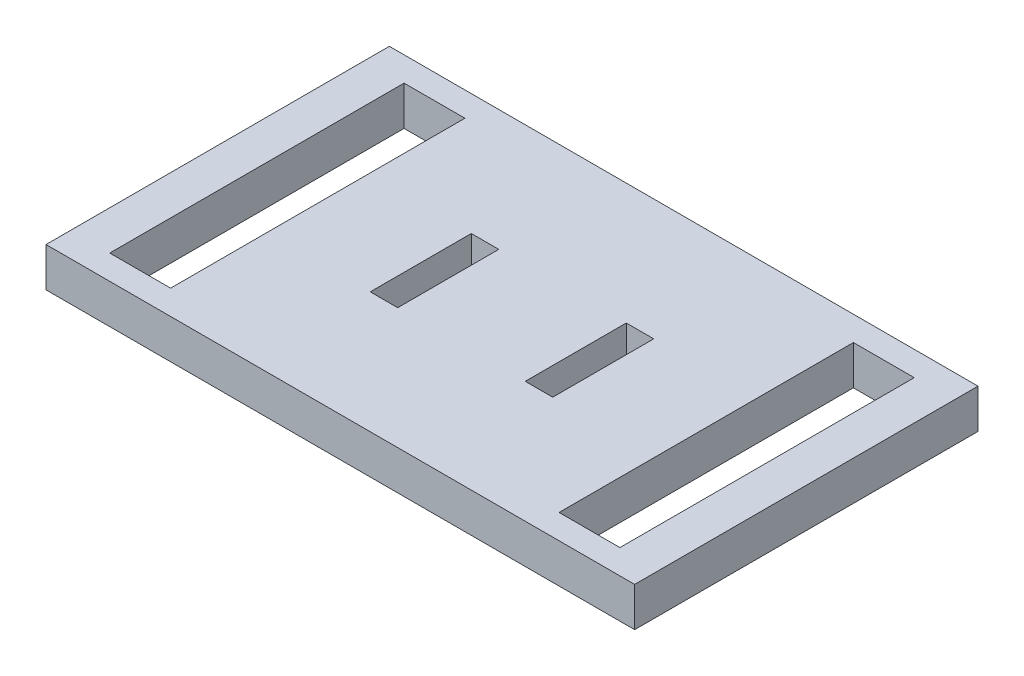
from build123d import *

# Parameters (mm, degrees)
SKETCH1_W           = 60
SKETCH1_H           = 35
SKETCH1_W_2         = 6.2
SKETCH1_H_2         = 30
SKETCH1_W_3         = 2.8
SKETCH1_H_3         = 10.3
BOSS_EXTRUDE1_DEPTH = 4


with BuildPart() as part:
    # Sketch1 → Boss-Extrude1 (new body)
    with BuildSketch(Plane(origin=(0, 0, 0), x_dir=(1, 0, 0), z_dir=(0, 1, 0))):
        with Locations((10.459310346, -10.747782501)):
            Rectangle(SKETCH1_W, SKETCH1_H)
        with Locations((-12.440689654, -10.747782501)):
            Rectangle(SKETCH1_W_2, SKETCH1_H_2, mode=Mode.SUBTRACT)
        with Locations((2.559310346, -10.747782501)):
            Rectangle(SKETCH1_W_3, SKETCH1_H_3, mode=Mode.SUBTRACT)
        with Locations((18.359310346, -10.747782501)):
            Rectangle(SKETCH1_W_3, SKETCH1_H_3, mode=Mode.SUBTRACT)
        with Locations((33.359310346, -10.747782501)):
            Rectangle(SKETCH1_W_2, SKETCH1_H_2, mode=Mode.SUBTRACT)
    extrude(amount=BOSS_EXTRUDE1_DEPTH)


solid = part.part
